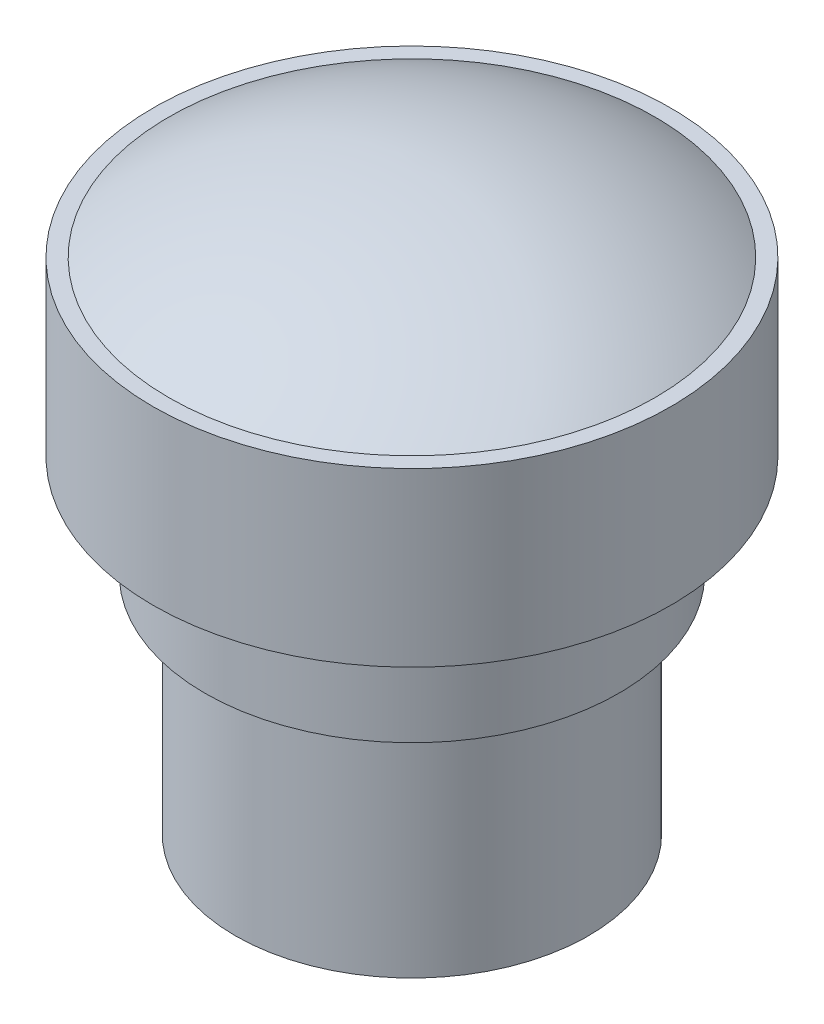
from build123d import *


with BuildPart() as part:
    # 草图1 → 旋转1 (revolve)
    with BuildSketch(Plane.XY, mode=Mode.PRIVATE) as revolve_1_sk:
        with BuildLine():
            Line((0, 0), (5.8, 0))
            Line((5.8, 0), (5.8, 7.4))
            Line((5.8, 7.4), (6.8, 7.4))
            Line((6.8, 7.4), (6.8, 10.75))
            Line((6.8, 10.75), (8.5, 10.75))
            Line((8.5, 10.75), (8.5, 16.4))
            Line((8.5, 16.4), (7.984359711, 16.4))
            ThreePointArc((7.984359711, 16.4), (4.183300133, 18.260389216), (0, 18.9))
            Line((0, 18.9), (0, 0))
        make_face()
    revolve(revolve_1_sk.sketch.rotate(Axis((0, 18.9, 0), (0, -1, 0)), 90), axis=Axis((0, 18.9, 0), (0, -1, 0)))


solid = part.part
